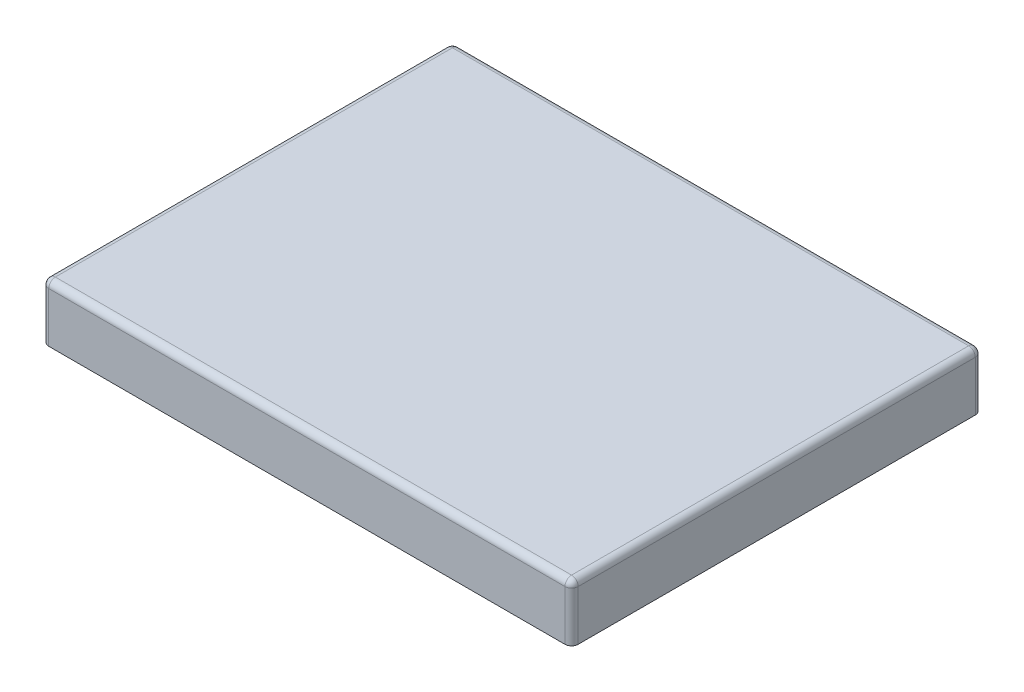
from build123d import *

# Parameters (mm, degrees)
SKETCH1_W           = 508
SKETCH1_H           = 393.7
SKETCH1_W_2         = 479.425
SKETCH1_H_2         = 365.125
BOSS_EXTRUDE1_DEPTH = 54.356
SKETCH2_W           = 393.7
SKETCH2_H           = 12.7
BOSS_EXTRUDE2_DEPTH = 508
FILLET1_R           = 6.35
FILLET2_R           = 6.35


with BuildPart() as part:
    # Sketch1 → Boss-Extrude1 (new body)
    with BuildSketch(Plane(origin=(0, 0, 0), x_dir=(1, 0, 0), z_dir=(0, 1, 0))):
        with Locations((254, 196.85)):
            Rectangle(SKETCH1_W, SKETCH1_H)
        with Locations((254, 196.8373)):
            Rectangle(SKETCH1_W_2, SKETCH1_H_2, mode=Mode.SUBTRACT)
    extrude(amount=BOSS_EXTRUDE1_DEPTH)

    # Sketch2 → Boss-Extrude2 (add)
    with BuildSketch(Plane(origin=(508, 0, 0), x_dir=(0, 0, -1), z_dir=(1, 0, 0))):
        with Locations((196.85, 48.006)):
            Rectangle(SKETCH2_W, SKETCH2_H)
    extrude(amount=-BOSS_EXTRUDE2_DEPTH)

    # Fillet1
    fillet1_edges = [part.edges().sort_by_distance(p)[0] for p in [
        (508, 54.356, -196.85),
        (254, 54.356, -393.7),
        (0, 54.356, -196.85),
        (254, 54.356, 0),
        (0, 27.178, -393.7),
        (508, 27.178, -393.7),
        (508, 27.178, 0),
        (0, 27.178, 0),
    ]]
    fillet(fillet1_edges, radius=FILLET1_R)

    # Fillet2
    fillet2_edges = [part.edges().sort_by_distance(p)[0] for p in [
        (493.7125, 20.828, -379.3998),
        (14.2875, 20.828, -379.3998),
        (254, 41.656, -379.3998),
        (493.7125, 20.828, -14.2748),
        (14.2875, 20.828, -14.2748),
        (254, 41.656, -14.2748),
        (14.2875, 41.656, -196.8373),
        (493.7125, 41.656, -196.8373),
    ]]
    fillet(fillet2_edges, radius=FILLET2_R)


solid = part.part
